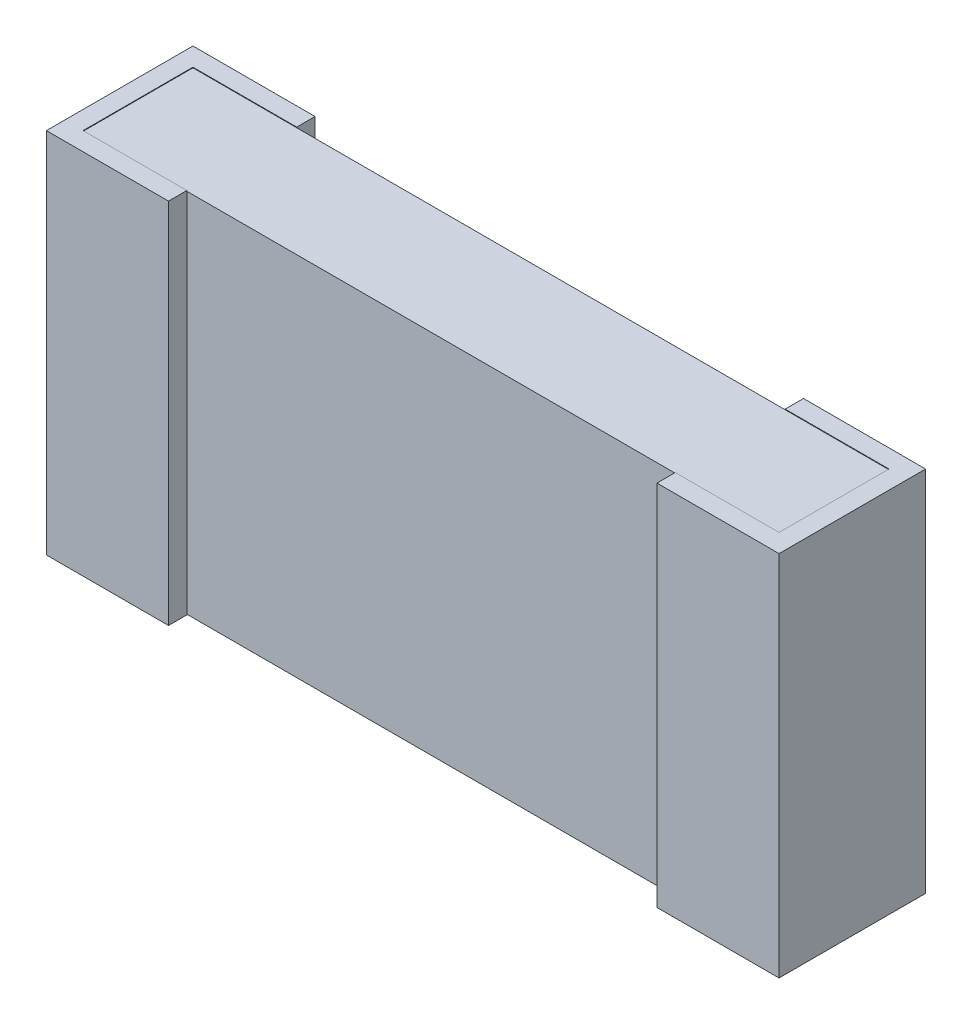
from build123d import *

# Parameters (mm, degrees)
SKETCH2_W           = 2.8956
SKETCH2_H           = 0.4572
BASE_EXTRUDE_DEPTH  = 0.762
BOSS_EXTRUDE8_DEPTH = 1.52908


with BuildPart() as part:
    # Sketch2 → Base-Extrude (new, symmetric)
    with BuildSketch(Plane(origin=(0, 0, 0), x_dir=(1, 0, 0), z_dir=(0, 1, 0))):
        with Locations((1.524, -0.3048)):
            Rectangle(SKETCH2_W, SKETCH2_H)
    extrude(amount=BASE_EXTRUDE_DEPTH, both=True)

    # Sketch3 → Boss-Extrude8 (add)
    with BuildSketch(Plane(origin=(0, 0.76454, 0), x_dir=(-1, 0, 0), z_dir=(0, 1, 0))):
        Polygon((-0.508, 0.6096), (-0.508, 0.5334), (-0.0762, 0.5334), (-0.0762, 0.0762), (-0.508, 0.0762), (-0.508, 0), (0, 0), (0, 0.6096), align=None)
    boss_extrude8 = extrude(amount=-BOSS_EXTRUDE8_DEPTH)

    # Mirror5: Boss-Extrude8 across plane
    add(boss_extrude8.mirror(Plane(origin=(1.524, 0, 0), x_dir=(0, 0, 1), z_dir=(1, 0, 0))))


solid = part.part
